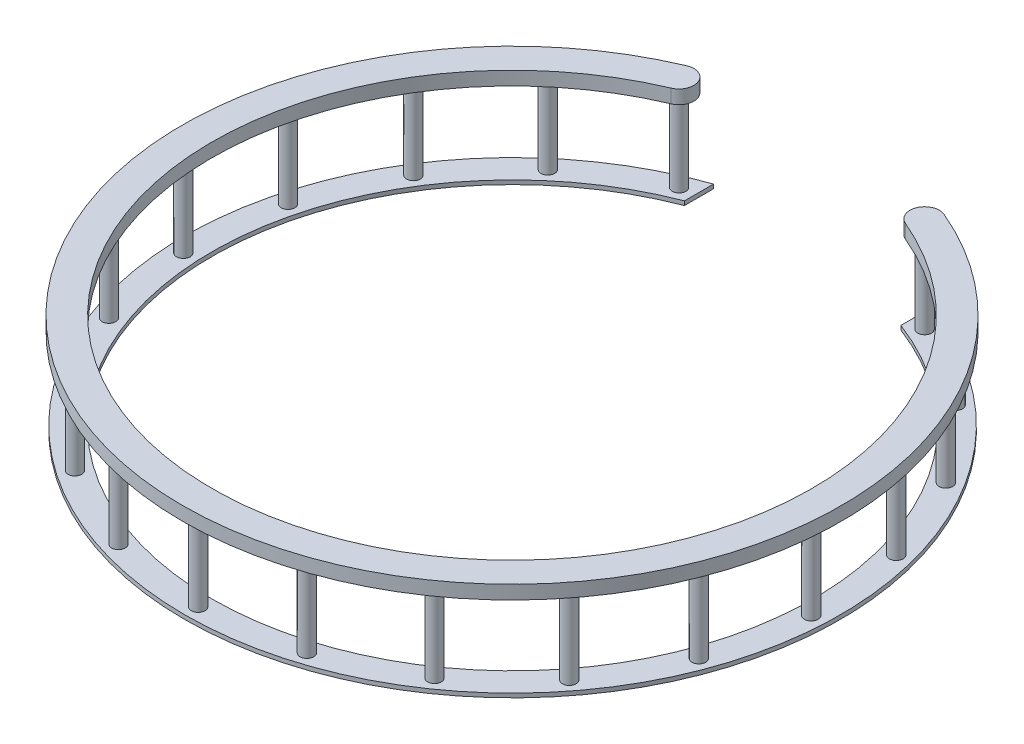
from build123d import *

# Parameters (mm, degrees)
SKETCH2_R                       = 12000
BOSS_EXTRUDE1_DEPTH             = 150
SKETCH4_R                       = 11000
CUT_EXTRUDE1_DEPTH              = 2000
SKETCH5_R                       = 250
BOSS_EXTRUDE4_DEPTH             = 3000
CIRPATTERN3_COUNT               = 10
CIRPATTERN3_ANGLE               = 157
CIRPATTERN3_THE_OTHER_WAY_COUNT = 10
CIRPATTERN3_THE_OTHER_WAY_ANGLE = 157
CUT_EXTRUDE3_DEPTH              = 5000
CUT_EXTRUDE3_DEPTH_BACK         = 3000
SKETCH8_W                       = 7905.077506289
SKETCH8_H                       = 3194.439171871
BOSS_EXTRUDE6_DEPTH             = 500


with BuildPart() as part:
    # Sketch2 → Boss-Extrude1 (new body)
    with BuildSketch(Plane(origin=(0, 0, 0), x_dir=(1, 0, 0), z_dir=(0, 1, 0))):
        with Locations(Location((0, 0, 0), (0, 0, 270))):
            Circle(SKETCH2_R)
    extrude(amount=BOSS_EXTRUDE1_DEPTH)

    # Sketch4 → Cut-Extrude1 (cut)
    with BuildSketch(Plane(origin=(0, 150, 0), x_dir=(1, 0, 0), z_dir=(0, 1, 0))):
        with Locations(Location((0, 0, 0), (0, 0, 270))):
            Circle(SKETCH4_R)
    extrude(amount=-CUT_EXTRUDE1_DEPTH, mode=Mode.SUBTRACT)

    # Sketch5 → Boss-Extrude4 (add)
    with BuildSketch(Plane(origin=(0, 150, 0), x_dir=(1, 0, 0), z_dir=(0, 1, 0))):
        with Locations(Location((0, -11500, 0), (0, 0, 270))):
            Circle(SKETCH5_R)
    boss_extrude4 = extrude(amount=BOSS_EXTRUDE4_DEPTH)

    # CirPattern3: Boss-Extrude4 ×10 about axis
    cirpattern3_axis = Axis((0, 0, 0), (0, -1, 0))
    for i in range(1, CIRPATTERN3_COUNT):
        add(boss_extrude4.rotate(cirpattern3_axis, i * CIRPATTERN3_ANGLE / (CIRPATTERN3_COUNT - 1)))

    # CirPattern3 the other way: Boss-Extrude4 ×10 about axis
    cirpattern3_the_other_way_axis = Axis((0, 0, 0), (0, 1, 0))
    for i in range(1, CIRPATTERN3_THE_OTHER_WAY_COUNT):
        add(boss_extrude4.rotate(cirpattern3_the_other_way_axis, i * CIRPATTERN3_THE_OTHER_WAY_ANGLE / (CIRPATTERN3_THE_OTHER_WAY_COUNT - 1)))

    # Sketch8 → Cut-Extrude3 (cut, two sides: drawn at the far end of the back side and taken through both)
    with BuildSketch(Plane(origin=(0, 150, 0), x_dir=(1, 0, 0), z_dir=(0, 1, 0)).offset(-CUT_EXTRUDE3_DEPTH_BACK)):
        with Locations((-16.088213452, 10597.219585936)):
            Rectangle(SKETCH8_W, SKETCH8_H)
    extrude(amount=CUT_EXTRUDE3_DEPTH + CUT_EXTRUDE3_DEPTH_BACK, mode=Mode.SUBTRACT)

    # Sketch9 → Boss-Extrude6 (add)
    with BuildSketch(Plane(origin=(0, 3150, 0), x_dir=(1, 0, 0), z_dir=(0, 1, 0))):
        with BuildLine():
            ThreePointArc((-4703.781603708, 11082.350526625), (0, -12077.648998423), (4703.781603708, 11082.350526625))
            ThreePointArc((4703.781603708, 11082.350526625), (3996.863265704, 10796.179440784), (4283.034351545, 10089.261102781))
            ThreePointArc((4283.034351545, 10089.261102781), (0, -10999.106067449), (-4283.034351545, 10089.261102781))
            ThreePointArc((-4283.034351545, 10089.261102781), (-3996.863265704, 10796.179440784), (-4703.781603708, 11082.350526625))
        make_face()
    extrude(amount=BOSS_EXTRUDE6_DEPTH)


solid = part.part
